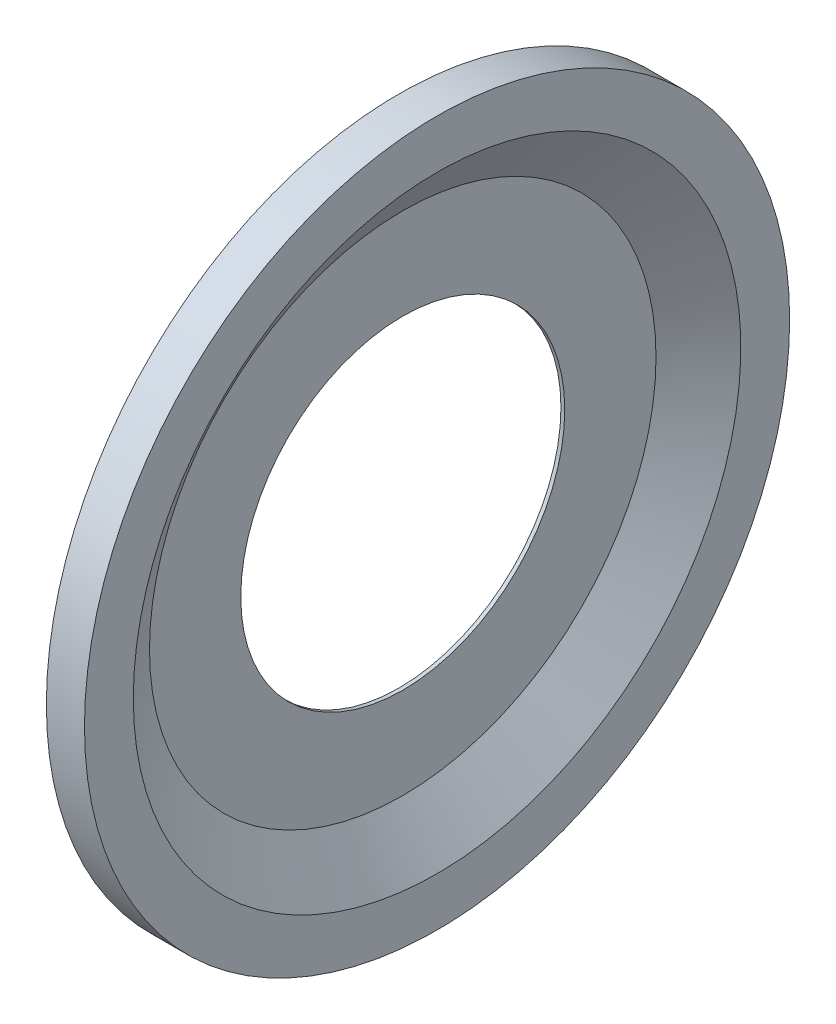
from build123d import *


with BuildPart() as part:
    # Esquisse1 → Révol.-Mince1 (revolve)
    with BuildSketch(Plane.XY, mode=Mode.PRIVATE) as r_vol_mince1_sk:
        Polygon((0, 8.5), (0, 13.35), (1.8, 16), (1.8, 18.3), (0, 18.3), (0, 18.5), (2, 18.5), (2, 15.938498478), (0.2, 13.288498478), (0.2, 8.5), align=None)
    revolve(r_vol_mince1_sk.sketch.rotate(Axis((-15.785310734, 0, 0), (1, 0, 0)), 90), axis=Axis((-15.785310734, 0, 0), (1, 0, 0)))


solid = part.part
